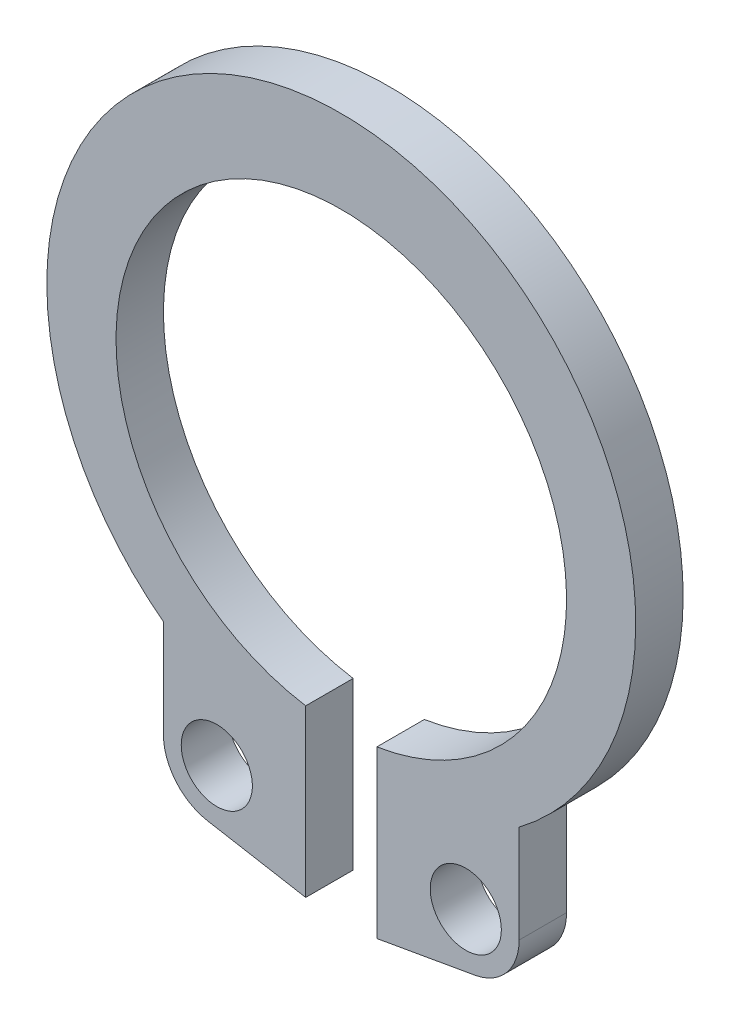
from build123d import *

# Parameters (mm, degrees)
BASE_EXTRUDE_DEPTH = 0.8
FILLET1_R          = 0.9
SKETCH2_R          = 0.6
CUT_EXTRUDE1_DEPTH = 9.260801437


with BuildPart() as part:
    # Sketch1 → Base-Extrude (new body)
    with BuildSketch(Plane.XY):
        with BuildLine():
            Line((-0.6, -3.752332608), (-0.6, -6.552332608))
            Line((-0.6, -6.552332608), (-3, -6.129147854))
            Line((-3, -6.129147854), (-3, -3.724921052))
            ThreePointArc((-3, -3.724921052), (0, 5.2), (3, -3.724921052))
            Line((3, -3.724921052), (3, -6.129147854))
            Line((3, -6.129147854), (0.6, -6.552332608))
            Line((0.6, -6.552332608), (0.6, -3.752332608))
            ThreePointArc((0.6, -3.752332608), (0, 3.8), (-0.6, -3.752332608))
        make_face()
    extrude(amount=BASE_EXTRUDE_DEPTH)

    # Fillet1
    fillet1_edges = [part.edges().sort_by_distance(p)[0] for p in [
        (3, -6.129147854, 0.4),
        (-3, -6.129147854, 0.4),
    ]]
    fillet(fillet1_edges, radius=FILLET1_R)

    # Sketch2 → Cut-Extrude1 (cut, through all)
    with BuildSketch(Plane.XY.offset(0.8)):
        with Locations((2.1, -5.373958186)):
            Circle(SKETCH2_R)
    cut_extrude1 = extrude(amount=-CUT_EXTRUDE1_DEPTH, mode=Mode.SUBTRACT)

    # Mirror1: Cut-Extrude1 across plane
    add(cut_extrude1.mirror(Plane(origin=(0, 0, 0), x_dir=(0, 0, 1), z_dir=(1, 0, 0))), mode=Mode.SUBTRACT)


solid = part.part
